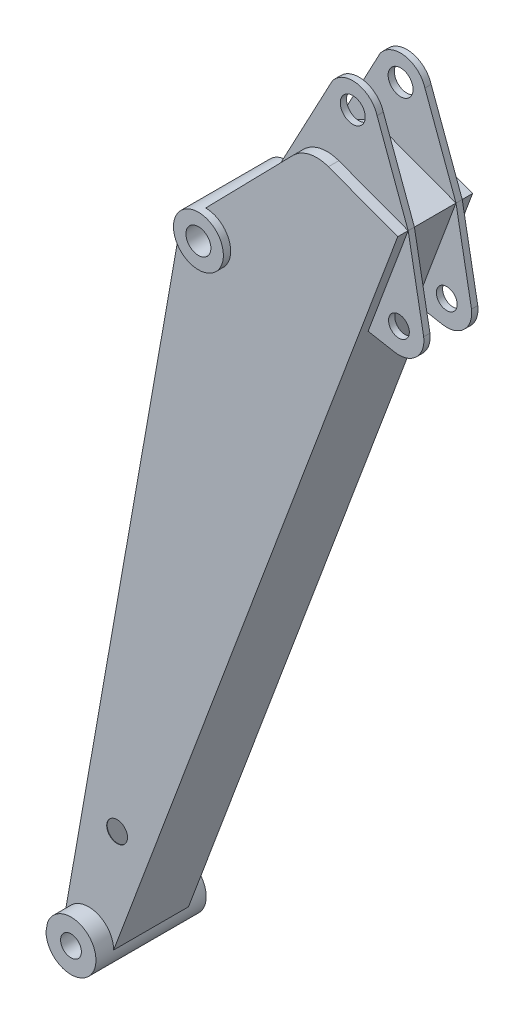
from build123d import *

# Parameters (mm, degrees)
BOSS_EXTRUDE7_DEPTH     = 132.5
BOSS_EXTRUDE8_DEPTH     = 107.5
BOSS_EXTRUDE11_DEPTH    = 90
BOSS_EXTRUDE13_DEPTH    = 15
BOSS_EXTRUDE14_DEPTH    = 15
CUT_EXTRUDE1_DEPTH      = 2219.3750456124794
CUT_EXTRUDE1_DEPTH_BACK = 2219.3750456124794
SKETCH9_R               = 25.00000000000001
CUT_EXTRUDE2_DEPTH      = 2219.3750456124794
CUT_EXTRUDE2_DEPTH_BACK = 2219.3750456124794
SKETCH10_R              = 25
SKETCH10_R_2            = 30.000000000000057
SKETCH10_R_3            = 25.00000000000001
CUT_EXTRUDE4_DEPTH      = 89
BOSS_EXTRUDE16_DEPTH    = 7.5
LPATTERN1_COUNT         = 2
LPATTERN1_PITCH         = 70
LPATTERN1_COUNT_DIR2    = 2
LPATTERN1_PITCH_DIR2    = 70


with BuildPart() as part:
    # Sketch1 → Boss-Extrude7 (new, symmetric)
    with BuildSketch(Plane.XY):
        with BuildLine():
            ThreePointArc((-60.00000000000001, 7.35e-15), (-1.102e-14, -60.00000000000001), (60.00000000000001, -1.47e-14))
            ThreePointArc((60.00000000000001, 0), (10.418890660014398, 59.08846518073274), (-56.3815572471555, 20.521208599537406))
            Line((-56.38155724715507, 20.5212085995373), (-60.00000000000001, 0))
        make_face()
    extrude(amount=BOSS_EXTRUDE7_DEPTH, both=True)



with BuildPart() as body_2:
    # Sketch1<4> → Boss-Extrude8 (new, symmetric)
    with BuildSketch(Plane.XY):
        with BuildLine():
            ThreePointArc((281.31004782042226, 1655.3885598797779), (238.8836409492294, 1637.8149667509708), (221.31004782042226, 1595.3885598797779))
            ThreePointArc((221.31004782042226, 1595.3885598797779), (281.31004782042226, 1535.3885598797779), (341.31004782042226, 1595.3885598797779))
            ThreePointArc((341.31004782042226, 1595.3885598797779), (323.7364546916151, 1637.8149667509706), (281.31004782042226, 1655.3885598797779))
        make_face()
    extrude(amount=BOSS_EXTRUDE8_DEPTH, both=True)


with BuildPart() as part_1:
    add(part.part)

    add(body_2.part)  # Boss-Extrude11 merges body 2
    # Sketch1<7> → Boss-Extrude11 (add, symmetric)
    with BuildSketch(Plane.XY):
        with BuildLine():
            ThreePointArc((-56.3815572471555, 20.521208599537406), (10.418890660014398, 59.08846518073274), (60.00000000000001, 0))
            Line((60.00000000000001, 0), (646.7224446980108, 1569.081173489734))
            Line((646.7224446980108, 1569.081173489734), (742.9728526854286, 1826.4851717149877))
            Line((742.9728526854286, 1826.4851717149877), (576.320357346008, 1888.8011061182426))
            ThreePointArc((576.320357346008, 1888.8011061182426), (530.9028583578195, 1891.9536301782764), (491.1198634823963, 1869.8176653013334))
            Line((491.1198634823963, 1869.8176653013334), (436.3758539114068, 1813.8683811248072))
            Line((436.3758539114068, 1813.8683811248072), (281.31004782042226, 1655.3885598797779))
            ThreePointArc((281.31004782042226, 1655.3885598797779), (323.7364546916151, 1637.8149667509706), (341.31004782042226, 1595.3885598797779))
            ThreePointArc((341.31004782042226, 1595.3885598797779), (281.31004782042226, 1535.3885598797779), (221.31004782042226, 1595.3885598797779))
            Line((221.3100478204223, 1595.3885598797783), (-56.38155724715507, 20.5212085995373))
        make_face()
    extrude(amount=BOSS_EXTRUDE11_DEPTH, both=True)

    # Sketch7 → Boss-Extrude13 (add)
    with BuildSketch(Plane.XY.offset(50)):
        with BuildLine():
            Line((491.11986348239617, 1869.8176653013334), (436.3758539114068, 1813.8683811248072))
            Line((436.3758539114068, 1813.8683811248072), (560.7517491875225, 2047.345886437859))
            ThreePointArc((560.7517491875225, 2047.345886437859), (620.3174364074071, 2071.284752328037), (668.241381159095, 2028.571336244537))
            Line((668.241381159095, 2028.571336244537), (742.9728526854286, 1826.4851717149877))
            Line((742.9728526854286, 1826.4851717149877), (576.320357346008, 1888.8011061182426))
            ThreePointArc((576.320357346008, 1888.8011061182426), (530.9028583578194, 1891.9536301782764), (491.11986348239617, 1869.8176653013334))
        make_face()
    boss_extrude13 = extrude(amount=BOSS_EXTRUDE13_DEPTH)

    # Mirror1: Boss-Extrude13 across plane
    add(boss_extrude13.mirror(Plane.XY))

    # Sketch8 → Boss-Extrude14 (add)
    with BuildSketch(Plane.XY.offset(50)):
        with BuildLine():
            Line((710.0562237456708, 1557.5550529992872), (646.722444698011, 1569.0811734897345))
            Line((646.722444698011, 1569.0811734897345), (742.9728526854286, 1826.4851717149877))
            Line((742.9728526854286, 1826.4851717149877), (780.2946008728494, 1624.3503879692228))
            ThreePointArc((780.2946008728494, 1624.3503879692228), (762.1465458997644, 1573.1067903464377), (710.0562237456708, 1557.5550529992872))
        make_face()
    boss_extrude14 = extrude(amount=BOSS_EXTRUDE14_DEPTH)

    # Mirror2: Boss-Extrude14 across plane
    add(boss_extrude14.mirror(Plane.XY))

    # Sketch9 → Cut-Extrude1 (cut, two sides: drawn at the far end of the back side and taken through both)
    with BuildSketch(Plane.XY.offset(-CUT_EXTRUDE1_DEPTH_BACK)):
        with Locations((68.38811575907259, 250.8447041954916)):
            Circle(SKETCH9_R)
    extrude(amount=CUT_EXTRUDE1_DEPTH + CUT_EXTRUDE1_DEPTH_BACK, mode=Mode.SUBTRACT)

    # Sketch10 → Cut-Extrude2 (cut, two sides: drawn at the far end of the back side and taken through both)
    with BuildSketch(Plane.XY.offset(-CUT_EXTRUDE2_DEPTH_BACK)):
        Circle(SKETCH10_R)
        with Locations((281.31004782042226, 1595.3885598797779)):
            Circle(SKETCH10_R_2)
        with Locations((609.8376069490902, 2011.284752328037)):
            Circle(SKETCH10_R_2)
        with Locations((720.7991732773353, 1616.5854607173449)):
            Circle(SKETCH10_R_3)
    extrude(amount=CUT_EXTRUDE2_DEPTH + CUT_EXTRUDE2_DEPTH_BACK, mode=Mode.SUBTRACT)

    # Sketch11 → Cut-Extrude4 (cut, symmetric)
    with BuildSketch(Plane.XY):
        with BuildLine():
            Line((-42.351656293378255, 42.50102597829323), (226.97630192688982, 1569.9357789476865))
            ThreePointArc((226.97630192688982, 1569.9357789476865), (328.2380746083149, 1558.0019272178915), (293.9773969442541, 1654.0361366939562))
            Line((293.9773969442541, 1654.0361366939562), (500.2412902493246, 1864.8412507570229))
            ThreePointArc((500.2412902493246, 1864.8412507570229), (533.0652528259412, 1882.2484835513376), (570.1744409589367, 1880.4229894000061))
            Line((570.1744409589367, 1880.4229894000061), (730.1038371756829, 1820.6210059763746))
            Line((730.1038371756829, 1820.6210059763746), (56.68161887354653, 19.677247822650788))
            ThreePointArc((56.68161887354653, 19.677247822650788), (13.474723344534803, 58.46735696769823), (-42.351656293378255, 42.50102597829323))
        make_face()
    extrude(amount=CUT_EXTRUDE4_DEPTH, both=True, mode=Mode.SUBTRACT)

    # Sketch13 → Boss-Extrude16 (add, symmetric)
    with BuildSketch(Plane.XY):
        with BuildLine():
            Line((-52.815446614608184, 40.74562699664585), (-57.6059989131423, 62.42999246636211))
            ThreePointArc((-57.6059989131423, 62.42999246636211), (-58.072295212476185, 66.31546702672539), (-57.77305039141961, 70.21736365978394))
            Line((-57.77305039141961, 70.21736365978394), (44.5186462495753, 650.3424031177195))
            ThreePointArc((44.5186462495753, 650.3424031177195), (45.368489936466986, 653.563955799229), (46.74134872827988, 656.5997250114111))
            Line((46.74134872827988, 656.5997250114111), (59.96272178968665, 680.3424031177195))
            Line((59.96272178968665, 680.3424031177195), (-52.815446614608184, 40.74562699664585))
        make_face()
    boss_extrude16 = extrude(amount=BOSS_EXTRUDE16_DEPTH, both=True)

    # LPattern1: Boss-Extrude16 2 × 2
    with Locations(*[Vector(0, 0, 1) * (i * LPATTERN1_PITCH) + Vector(0, 0, -1) * (j * LPATTERN1_PITCH_DIR2) for i in range(LPATTERN1_COUNT) for j in range(LPATTERN1_COUNT_DIR2) if (i, j) != (0, 0)]):
        add(boss_extrude16)


solid = part_1.part
